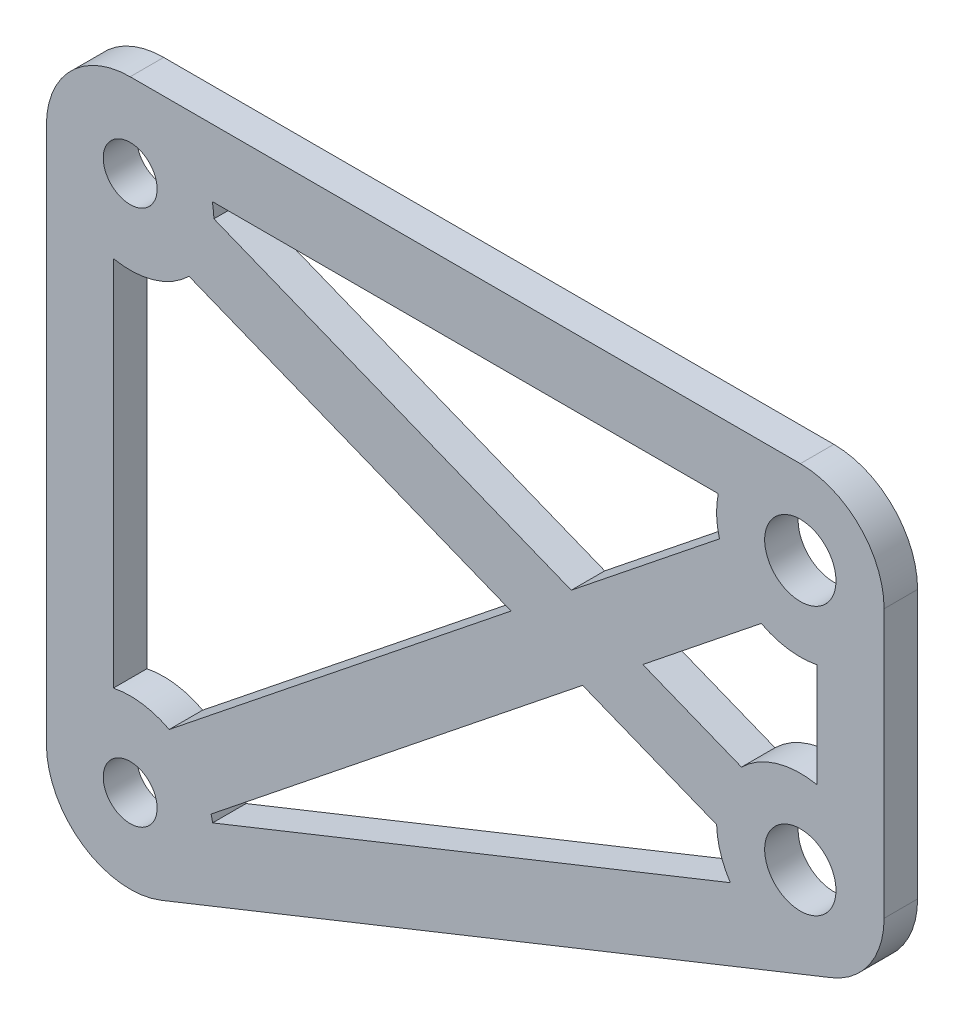
from build123d import *

# Parameters (mm, degrees)
BOSS_EXTRUDE1_DEPTH     = 3.175
F_1_4_CLEARANCE_HOLE1_D = 6.7564
F_10_CLEARANCE_HOLE1_D  = 5.1054
CUT_EXTRUDE1_DEPTH      = 93.539131925


with BuildPart() as part:
    # Sketch1 → Boss-Extrude1 (new body)
    with BuildSketch(Plane.XY):
        with BuildLine():
            Line((0, 58.7375), (63.5, 58.7375))
            ThreePointArc((63.5, 58.7375), (69.112660076, 56.412660076), (71.4375, 50.8))
            Line((71.4375, 50.8), (71.4375, 25.4))
            ThreePointArc((71.4375, 25.4), (70.072783642, 20.950008826), (66.447913494, 18.030216266))
            Line((66.447913494, 18.030216266), (2.947913494, -7.369783734))
            ThreePointArc((2.947913494, -7.369783734), (-4.449991174, -6.572783642), (-7.9375, 0))
            Line((-7.9375, 0), (-7.9375, 50.8))
            ThreePointArc((-7.9375, 50.8), (-5.612660076, 56.412660076), (0, 58.7375))
        make_face()
    extrude(amount=BOSS_EXTRUDE1_DEPTH)

    # 1/4 Clearance Hole1 (through all)
    with Locations(Plane.XY.offset(3.175)):
        with Locations((63.5, 50.8), (63.5, 25.4)):
            Hole(F_1_4_CLEARANCE_HOLE1_D / 2)

    # #10 Clearance Hole1 (through all)
    with Locations(Plane.XY.offset(3.175)):
        with Locations((0, 50.8), (0, 0)):
            Hole(F_10_CLEARANCE_HOLE1_D / 2)

    # Sketch6 → Cut-Extrude1 (cut, through all)
    with BuildSketch(Plane.XY.offset(3.175)):
        with BuildLine():
            Line((36.095363714, 32.942274862), (5.575352966, 45.150279161))
            ThreePointArc((5.575352966, 45.150279161), (2.259913756, 43.191012152), (-1.5875, 43.022870067))
            Line((-1.5875, 43.022870067), (-1.5875, 7.777129933))
            ThreePointArc((-1.5875, 7.777129933), (1.120121639, 7.858068068), (3.697288027, 7.023814312))
            Line((3.697288027, 7.023814312), (36.095363714, 32.942274862))
        make_face()
        with BuildLine():
            Line((7.933683761, 51.046106148), (41.794663135, 37.501714399))
            Line((41.794663135, 37.501714399), (55.835898421, 48.734702628))
            ThreePointArc((55.835898421, 48.734702628), (55.566297219, 50.554507771), (55.722870067, 52.3875))
            Line((55.722870067, 52.3875), (7.777129933, 52.3875))
            ThreePointArc((7.777129933, 52.3875), (7.883987005, 51.720138659), (7.933683761, 51.046106148))
        make_face()
        with BuildLine():
            Line((59.802711973, 43.776185688), (48.571302953, 34.791058471))
            Line((48.571302953, 34.791058471), (57.924647034, 31.049720839))
            ThreePointArc((57.924647034, 31.049720839), (61.240086244, 33.008987848), (65.0875, 33.177129933))
            Line((65.0875, 33.177129933), (65.0875, 43.022870067))
            ThreePointArc((65.0875, 43.022870067), (62.379878361, 42.941931932), (59.802711973, 43.776185688))
        make_face()
        with BuildLine():
            Line((55.566316239, 25.153893852), (42.872003532, 30.231618935))
            Line((42.872003532, 30.231618935), (7.664101579, 2.065297372))
            ThreePointArc((7.664101579, 2.065297372), (7.744125689, 1.741385529), (7.810466564, 1.414396799))
            Line((7.810466564, 1.414396799), (56.868698834, 21.037689707))
            ThreePointArc((56.868698834, 21.037689707), (55.932273748, 23.005542728), (55.566316239, 25.153893852))
        make_face()
    extrude(amount=-CUT_EXTRUDE1_DEPTH, mode=Mode.SUBTRACT)


solid = part.part
